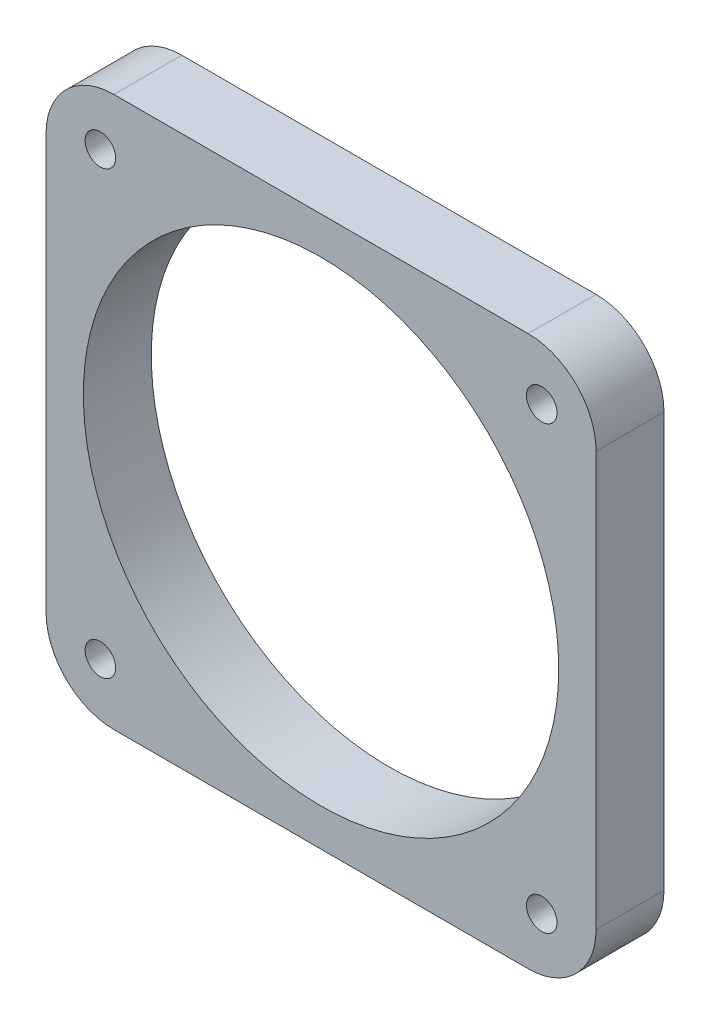
from build123d import *

# Parameters (mm, degrees)
SKETCH1_R           = 4.5
SKETCH1_R_2         = 70
BOSS_EXTRUDE1_DEPTH = 20


with BuildPart() as part:
    # Sketch1 → Boss-Extrude1 (new body)
    with BuildSketch(Plane.XY):
        with BuildLine():
            Line((-61, -81), (61, -81))
            ThreePointArc((61, -81), (75.142135624, -75.142135624), (81, -61))
            Line((81, -61), (81, 61))
            ThreePointArc((81, 61), (75.142135624, 75.142135624), (61, 81))
            Line((61, 81), (-61, 81))
            ThreePointArc((-61, 81), (-75.142135624, 75.142135624), (-81, 61))
            Line((-81, 61), (-81, -61))
            ThreePointArc((-81, -61), (-75.142135624, -75.142135624), (-61, -81))
        make_face()
        with Locations((-65, 65)):
            Circle(SKETCH1_R, mode=Mode.SUBTRACT)
        with Locations((65, 65)):
            Circle(SKETCH1_R, mode=Mode.SUBTRACT)
        with Locations((65, -65)):
            Circle(SKETCH1_R, mode=Mode.SUBTRACT)
        with Locations((-65, -65)):
            Circle(SKETCH1_R, mode=Mode.SUBTRACT)
        Circle(SKETCH1_R_2, mode=Mode.SUBTRACT)
    extrude(amount=BOSS_EXTRUDE1_DEPTH)


solid = part.part
